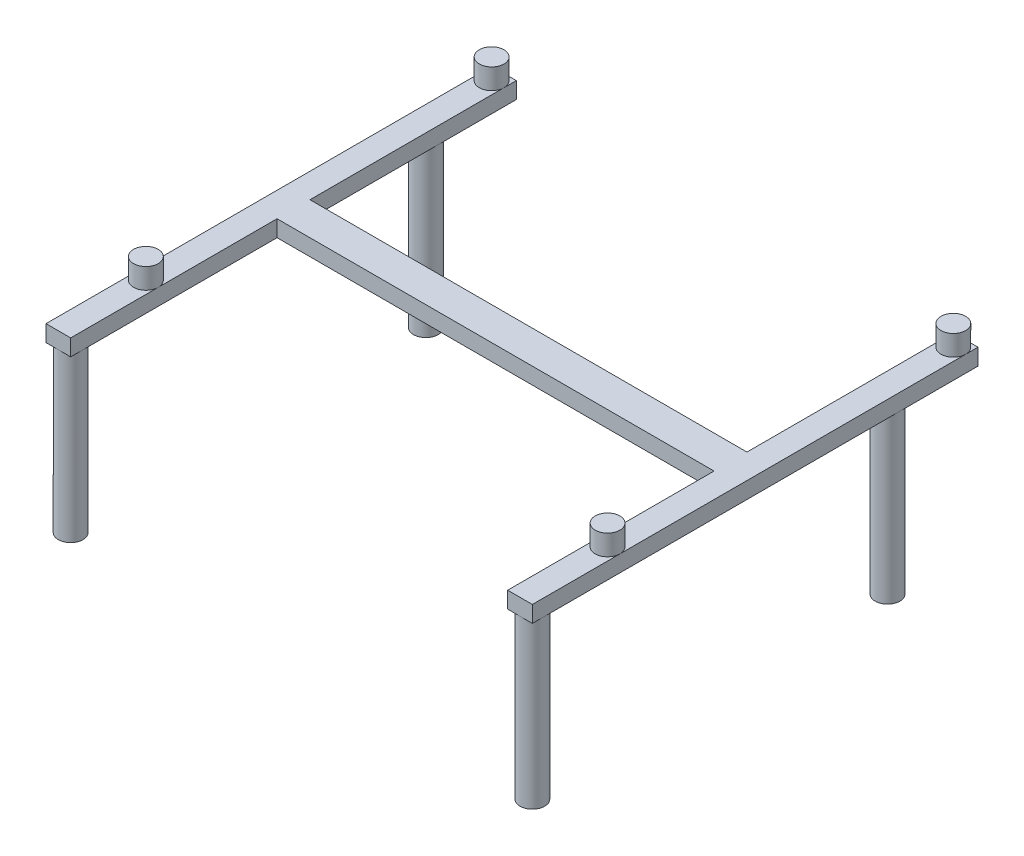
from build123d import *

# Parameters (mm, degrees)
SKETCH_1_R        = 1.5
EXTRUDE_1_DEPTH   = 20
EXTRUDE_1_2_DEPTH = 20
EXTRUDE_1_3_DEPTH = 20
EXTRUDE_1_4_DEPTH = 20
EXTRUDE_2_DEPTH   = 2
SKETCH_4_R        = 1.5
EXTRUDE_3_DEPTH   = 2.5


with BuildPart() as part:
    # 草图1 → 凸台-拉伸1 (new body)
    with BuildSketch(Plane(origin=(0, 0, 0), x_dir=(1, 0, 0), z_dir=(0, 1, 0))):
        with Locations(Location((0, 0, 0), (0, 0, 270))):
            Circle(SKETCH_1_R)
    extrude(amount=EXTRUDE_1_DEPTH)



with BuildPart() as body_2:
    # 草图1 → Extrude 1 2 (new body)
    with BuildSketch(Plane(origin=(0, 0, 0), x_dir=(1, 0, 0), z_dir=(0, 1, 0))):
        with Locations(Location((0, 43.18, 0), (0, 0, 270))):
            Circle(SKETCH_1_R)
    extrude(amount=EXTRUDE_1_2_DEPTH)


with BuildPart() as body_3:
    # 草图1 → Extrude 1 3 (new body)
    with BuildSketch(Plane(origin=(0, 0, 0), x_dir=(1, 0, 0), z_dir=(0, 1, 0))):
        with Locations(Location((56.13, 43.18, 0), (0, 0, 270))):
            Circle(SKETCH_1_R)
    extrude(amount=EXTRUDE_1_3_DEPTH)


with BuildPart() as body_4:
    # 草图1 → Extrude 1 4 (new body)
    with BuildSketch(Plane(origin=(0, 0, 0), x_dir=(1, 0, 0), z_dir=(0, 1, 0))):
        with Locations(Location((56.13, 0, 0), (0, 0, 270))):
            Circle(SKETCH_1_R)
    extrude(amount=EXTRUDE_1_4_DEPTH)


with BuildPart() as part_1:
    add(part.part)

    add(body_2.part)  # 凸台-拉伸2 merges body 2
    # 草图2 → 凸台-拉伸2 (add)
    with BuildSketch(Plane(origin=(0, 20, 0), x_dir=(1, 0, 0), z_dir=(0, 1, 0))):
        Polygon((-1.5, 52.68), (-1.5, -1.5), (1.5, -1.5), (1.5, 23.59), (54.63, 23.59), (54.63, -1.5), (57.63, -1.5), (57.63, 52.68), (54.63, 52.68), (54.63, 27.59), (1.5, 27.59), (1.5, 52.68), align=None)
    extrude(amount=EXTRUDE_2_DEPTH)

    # 草图4 → 凸台-拉伸3 (add)
    with BuildSketch(Plane(origin=(0, 22, 0), x_dir=(1, 0, 0), z_dir=(0, 1, 0))):
        with Locations(Location((0, 51.18, 0), (0, 0, 90))):
            Circle(SKETCH_4_R)
        with Locations(Location((0, 9.143, 0), (0, 0, 180))):
            Circle(SKETCH_4_R)
        with Locations(Location((56.13, 9.143, 0), (0, 0, 90))):
            Circle(SKETCH_4_R)
        with Locations(Location((56.13, 51.18, 0), (0, 0, 90))):
            Circle(SKETCH_4_R)
    extrude(amount=EXTRUDE_3_DEPTH)


solid = Compound([body_3.part, body_4.part, part_1.part])
